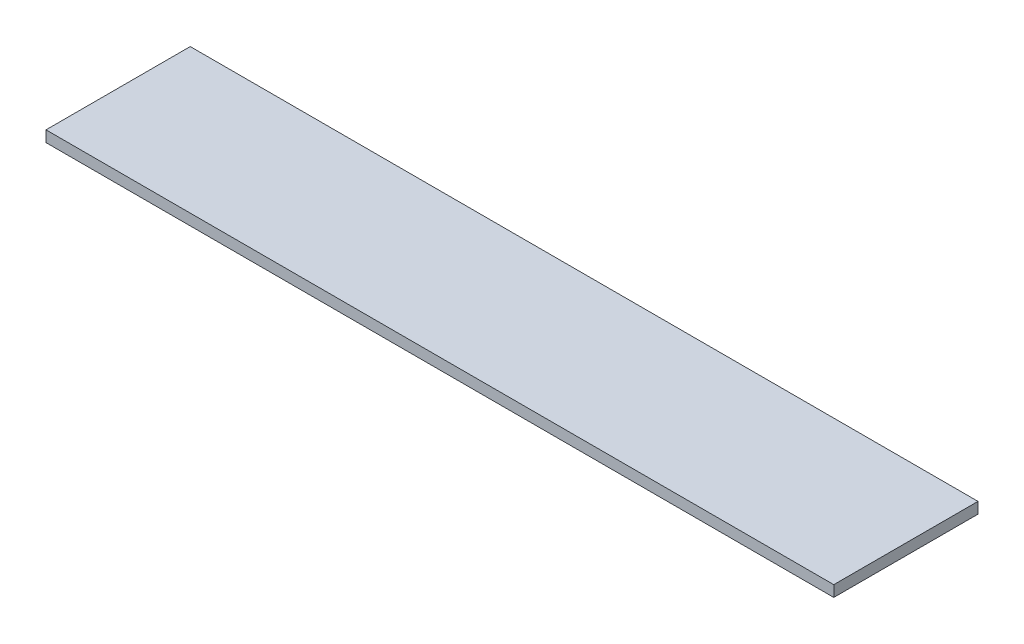
from build123d import *

# Parameters (mm, degrees)
SKETCH1_W             = 71
SKETCH1_H             = 13
BOSS_EXTRUDE1_DEPTH   = 1
BODY_MOVE_COPY1_ANGLE = 90


with BuildPart() as part:
    # Sketch1 → Boss-Extrude1 (new body)
    with BuildSketch(Plane.XY):
        with Locations((7.188888889, 9.605555556)):
            Rectangle(SKETCH1_W, SKETCH1_H)
    extrude(amount=BOSS_EXTRUDE1_DEPTH)


with BuildPart() as part_1:
    # Body-Move/Copy1: moved
    add(part.part.rotate(Axis((0, 9.605555556, 0.25), (1, 0, 0)), BODY_MOVE_COPY1_ANGLE))


solid = part_1.part
